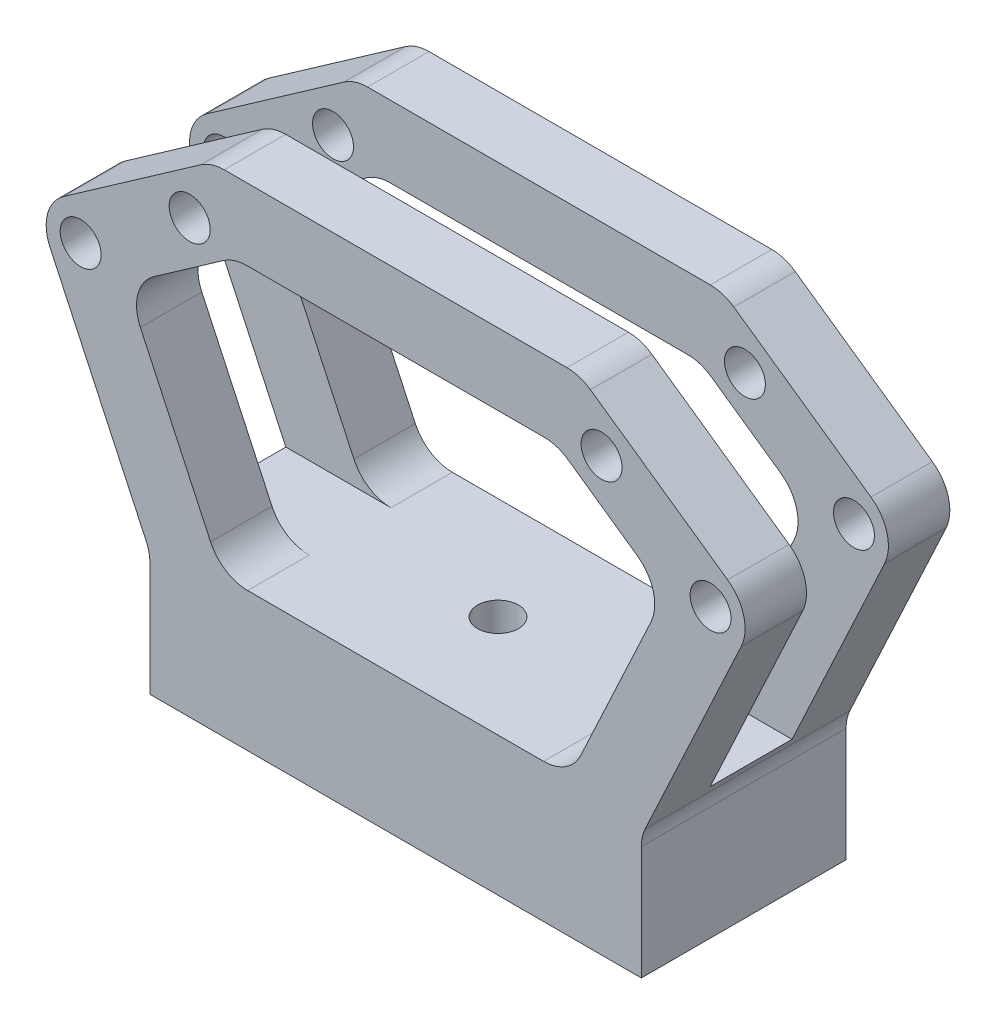
from build123d import *

# Parameters (mm, degrees)
SKETCH2_R               = 5
BOSS_EXTRUDE2_DEPTH     = 50
FILLET1_R               = 10
CUT_EXTRUDE1_DEPTH      = 195.993878356
CUT_EXTRUDE1_DEPTH_BACK = 195.993878356
SKETCH3_W               = 20
SKETCH3_H               = 86.120343404
SKETCH4_R               = 5
CUT_EXTRUDE2_DEPTH      = 156.50648845


with BuildPart() as part:
    # Sketch2 → Boss-Extrude2 (new body)
    with BuildSketch(Plane.XY):
        Polygon((0, 120), (-45, 120), (-87.945471533, 89.9292571), (-60, 30), (-60, 0), (0, 0), (60, 0), (60, 30), (87.945471533, 89.9292571), (45, 120), align=None)
        with Locations((-50.289922216, 105.614178936)):
            Circle(SKETCH2_R, mode=Mode.SUBTRACT)
        with Locations((-76.912363656, 86.972944754)):
            Circle(SKETCH2_R, mode=Mode.SUBTRACT)
        with Locations(Location((76.912363656, 86.972944754, 0), (0, 0, 180))):
            Circle(SKETCH2_R, mode=Mode.SUBTRACT)
        with Locations(Location((50.289922216, 105.614178936, 0), (0, 0, 180))):
            Circle(SKETCH2_R, mode=Mode.SUBTRACT)
        Polygon((0, 102.5), (-39.482271195, 102.5), (-65.879255778, 84.016632409), (-42.5, 33.879656596), (42.5, 33.879656596), (65.879255778, 84.016632409), (39.482271195, 102.5), align=None, mode=Mode.SUBTRACT)
    extrude(amount=BOSS_EXTRUDE2_DEPTH)

    # Fillet1
    fillet1_edges = [part.edges().sort_by_distance(p)[0] for p in [
        (-45, 120, 25),
        (45, 120, 25),
        (87.945471533, 89.9292571, 25),
        (60, 30, 25),
        (-60, 30, 25),
        (-87.945471533, 89.9292571, 25),
        (65.879255778, 84.016632409, 25),
        (39.482271195, 102.5, 25),
        (-39.482271195, 102.5, 25),
        (-65.879255778, 84.016632409, 25),
        (-42.5, 33.879656596, 25),
        (42.5, 33.879656596, 25),
    ]]
    fillet(fillet1_edges, radius=FILLET1_R)

    # Sketch3 → Cut-Extrude1 (cut, two sides: drawn at the far end of the back side and taken through both)
    with BuildSketch(Plane.ZY.offset(60).offset(-CUT_EXTRUDE1_DEPTH_BACK)):
        with Locations((25, 76.939828298)):
            Rectangle(SKETCH3_W, SKETCH3_H)
    extrude(amount=CUT_EXTRUDE1_DEPTH + CUT_EXTRUDE1_DEPTH_BACK, mode=Mode.SUBTRACT)

    # Sketch4 → Cut-Extrude2 (cut, through all)
    with BuildSketch(Plane.XZ):
        with Locations(Location((0, 25, 0), (0, 0, 270))):
            Circle(SKETCH4_R)
    extrude(amount=-CUT_EXTRUDE2_DEPTH, mode=Mode.SUBTRACT)


solid = part.part
